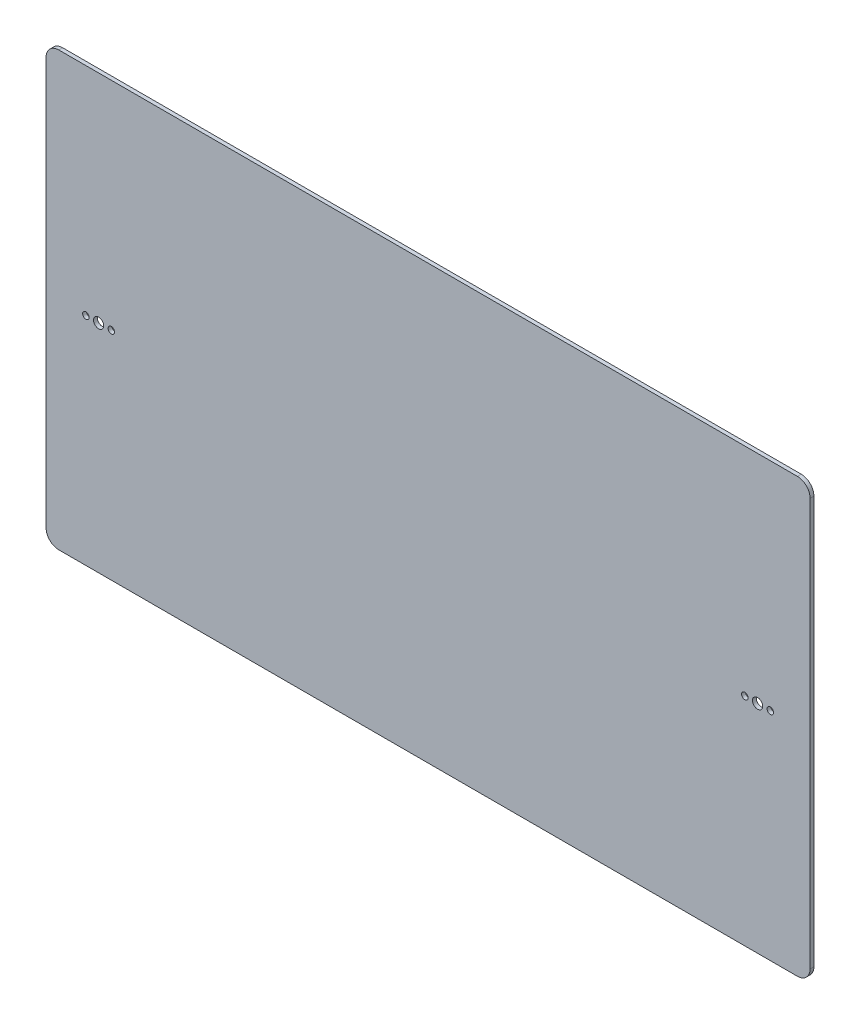
from build123d import *

# Parameters (mm, degrees)
CROQUIS1_R              = 4
CROQUIS1_R_2            = 2.55
SALIENTE_EXTRUIR1_DEPTH = 3


with BuildPart() as part:
    # Croquis1 → Saliente-Extruir1 (new body)
    with BuildSketch(Plane.XY):
        with BuildLine():
            Line((-290, 170), (290, 170))
            ThreePointArc((290, 170), (297.071067812, 167.071067812), (300, 160))
            Line((300, 160), (300, -160))
            ThreePointArc((300, -160), (297.071067812, -167.071067812), (290, -170))
            Line((290, -170), (-290, -170))
            ThreePointArc((-290, -170), (-297.071067812, -167.071067812), (-300, -160))
            Line((-300, -160), (-300, 160))
            ThreePointArc((-300, 160), (-297.071067812, 167.071067812), (-290, 170))
        make_face()
        with Locations((258.75, 0)):
            Circle(CROQUIS1_R, mode=Mode.SUBTRACT)
        with Locations((248.75, 0)):
            Circle(CROQUIS1_R_2, mode=Mode.SUBTRACT)
        with Locations((268.75, 0)):
            Circle(CROQUIS1_R_2, mode=Mode.SUBTRACT)
        with Locations(Location((-268.75, 0, 0), (0, 0, 180))):
            Circle(CROQUIS1_R_2, mode=Mode.SUBTRACT)
        with Locations(Location((-248.75, 0, 0), (0, 0, 180))):
            Circle(CROQUIS1_R_2, mode=Mode.SUBTRACT)
        with Locations(Location((-258.75, 0, 0), (0, 0, 180))):
            Circle(CROQUIS1_R, mode=Mode.SUBTRACT)
    extrude(amount=SALIENTE_EXTRUIR1_DEPTH)


solid = part.part
